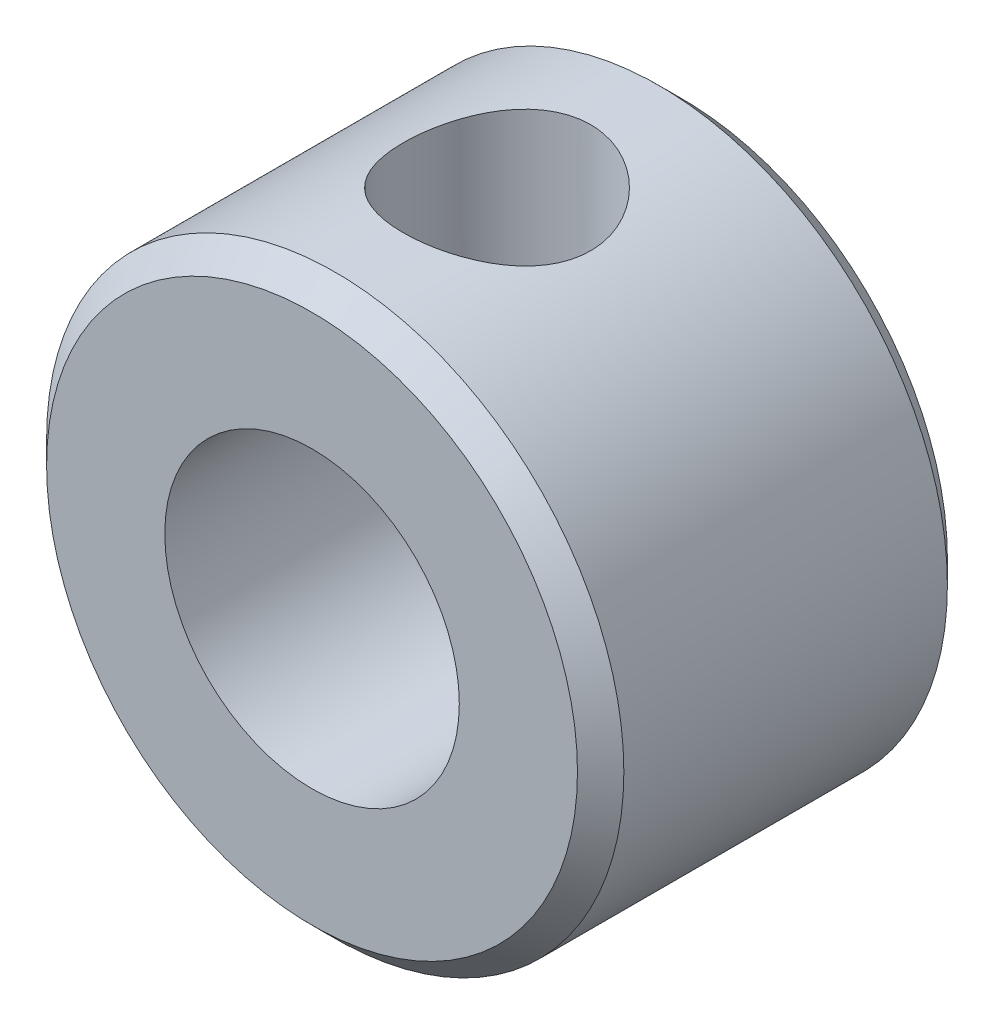
from build123d import *

# Parameters (mm, degrees)
SKETCH1_R     = 6.223
SKETCH1_R_2   = 3.175
CHAMFER1_SIZE = 0.5
SKETCH4_W     = 2.0193
SKETCH4_H     = 6.223


with BuildPart() as part:
    # Sweep1: sweep along a path in Sketch2
    with BuildLine(Plane(origin=(0, 0, 0), x_dir=(1, 0, 0), z_dir=(0, 1, 0))) as sweep1_path:
        Line((0, -3.9878), (0, 3.9878))
    # Sketch1 → Sweep1 (sweep)
    with BuildSketch(Plane.XY):
        Circle(SKETCH1_R)
        Circle(SKETCH1_R_2, mode=Mode.SUBTRACT)
    sweep(path=sweep1_path.line)

    # Chamfer1
    chamfer1_edges = [part.edges().sort_by_distance(p)[0] for p in [
        (-6.223, 0, 3.9878),
        (-6.223, 0, -3.9878),
    ]]
    chamfer(chamfer1_edges, length=CHAMFER1_SIZE)

    # Sketch4 → Tap Drill for #10-32 Tap1 (revolve, cut)
    with BuildSketch(Plane(origin=(0, 0, 0), x_dir=(0, 0, -1), z_dir=(1, 0, 0))):
        with Locations((1.00965, 3.1115)):
            Rectangle(SKETCH4_W, SKETCH4_H)
    revolve(axis=Axis((0, -6.35, 0), (0, 1, 0)), mode=Mode.SUBTRACT)


solid = part.part
